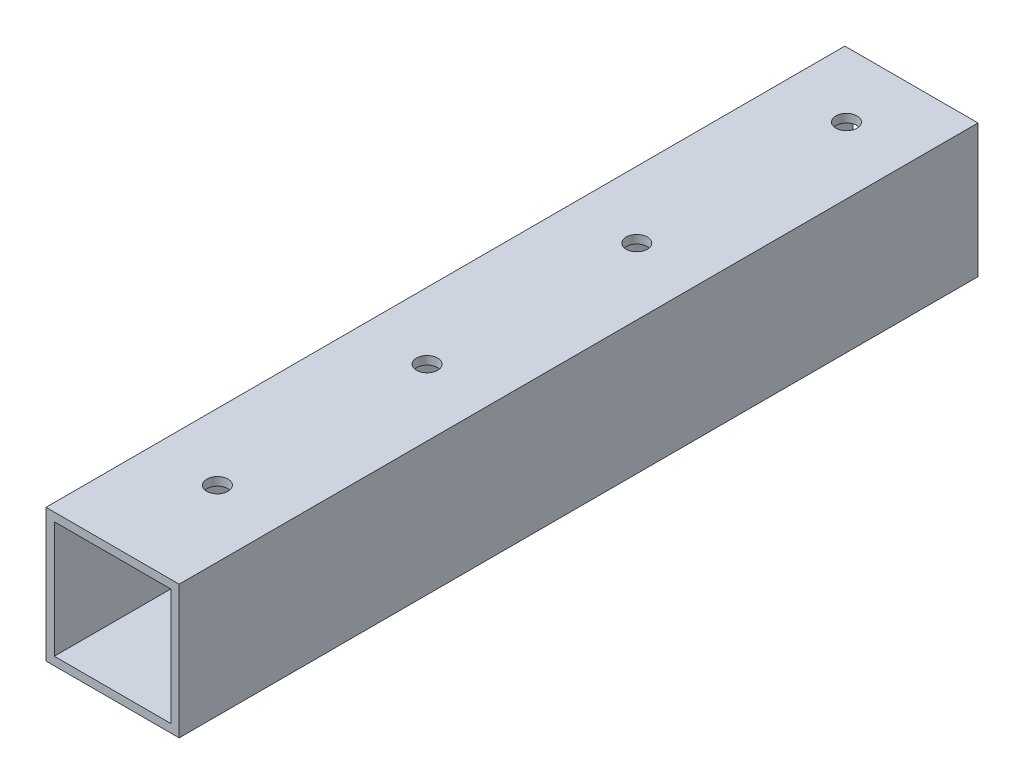
from build123d import *

# Parameters (mm, degrees)
SKETCH1_W               = 50.8
SKETCH1_H               = 50.8
SKETCH1_W_2             = 44.45
SKETCH1_H_2             = 44.45
BOSS_EXTRUDE1_DEPTH     = 304.8
CUT_EXTRUDE1_DEPTH      = 304.8
CUT_EXTRUDE1_DEPTH_BACK = 304.8
SKETCH2_R               = 4.05


with BuildPart() as part:
    # Sketch1 → Boss-Extrude1 (new body)
    with BuildSketch(Plane.XY):
        Rectangle(SKETCH1_W, SKETCH1_H)
        Rectangle(SKETCH1_W_2, SKETCH1_H_2, mode=Mode.SUBTRACT)
    extrude(amount=-BOSS_EXTRUDE1_DEPTH)

    # Sketch2 → Cut-Extrude1 (cut, two sides: drawn at the far end of the back side and taken through both)
    with BuildSketch(Plane(origin=(0, 0, 0), x_dir=(1, 0, 0), z_dir=(0, 1, 0)).offset(-CUT_EXTRUDE1_DEPTH_BACK)):
        with Locations(Location((0, 40, 0), (0, 0, 90))):
            Circle(SKETCH2_R)
        with Locations(Location((0, 120, 0), (0, 0, 90))):
            Circle(SKETCH2_R)
        with Locations(Location((0, 200, 0), (0, 0, 90))):
            Circle(SKETCH2_R)
        with Locations(Location((0, 280, 0), (0, 0, 90))):
            Circle(SKETCH2_R)
    extrude(amount=CUT_EXTRUDE1_DEPTH + CUT_EXTRUDE1_DEPTH_BACK, mode=Mode.SUBTRACT)


solid = part.part
